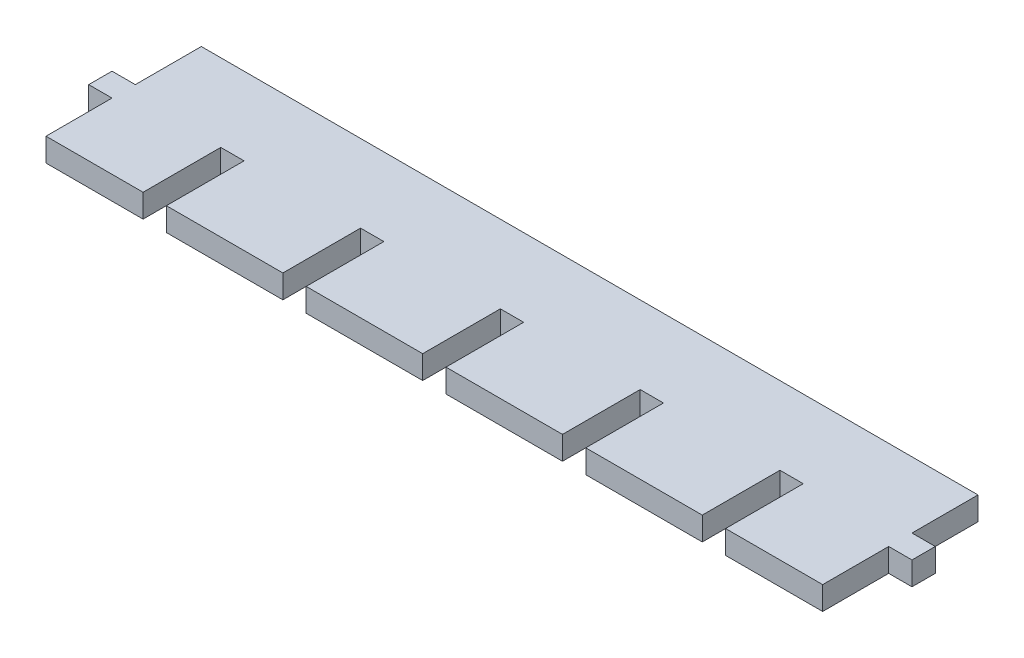
from build123d import *

# Parameters (mm, degrees)
BOSS_EXTRUDE1_DEPTH = 6


with BuildPart() as part:
    # Sketch1 → Boss-Extrude1 (new body)
    with BuildSketch(Plane(origin=(0, 0, 0), x_dir=(1, 0, 0), z_dir=(0, 1, 0))):
        Polygon((0, 0), (-30, 0), (-30, 20), (-36, 20), (-36, 0), (-66, 0), (-66, 20), (-72, 20), (-72, 0), (-97, 0), (-97, 17), (-103, 17), (-103, 23), (-97, 23), (-97, 40), (103, 40), (103, 23), (109, 23), (109, 17), (103, 17), (103, 0), (78, 0), (78, 20), (72, 20), (72, 0), (42, 0), (42, 20), (36, 20), (36, 0), (6, 0), (6, 20), (0, 20), align=None)
    extrude(amount=BOSS_EXTRUDE1_DEPTH)


solid = part.part
